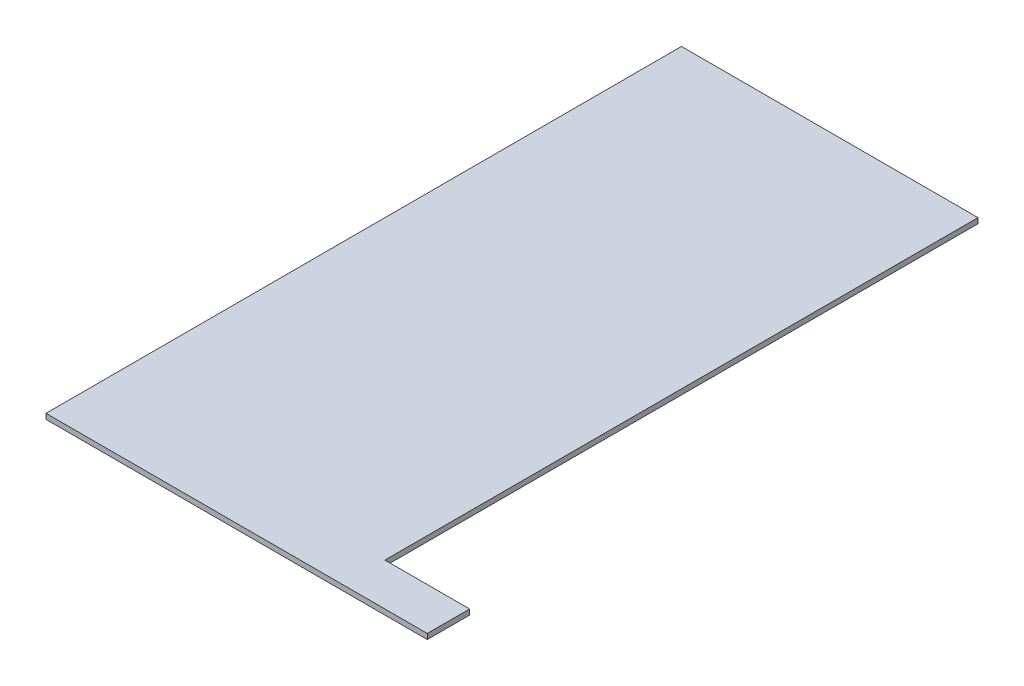
from build123d import *

# Parameters (mm, degrees)
SKETCH1_W           = 25.4
SKETCH1_H           = 12.7
BOSS_EXTRUDE1_DEPTH = 1.5875


with BuildPart() as part:
    # Sketch1 → Boss-Extrude1 (new body)
    with BuildSketch(Plane(origin=(0, 0, 0), x_dir=(1, 0, 0), z_dir=(0, 1, 0))):
        Polygon((-44.45, -95.25), (44.45, -95.25), (44.45, -82.55), (44.45, 95.25), (-44.45, 95.25), align=None)
        with Locations((57.15, -88.9)):
            Rectangle(SKETCH1_W, SKETCH1_H)
    extrude(amount=BOSS_EXTRUDE1_DEPTH)


solid = part.part
